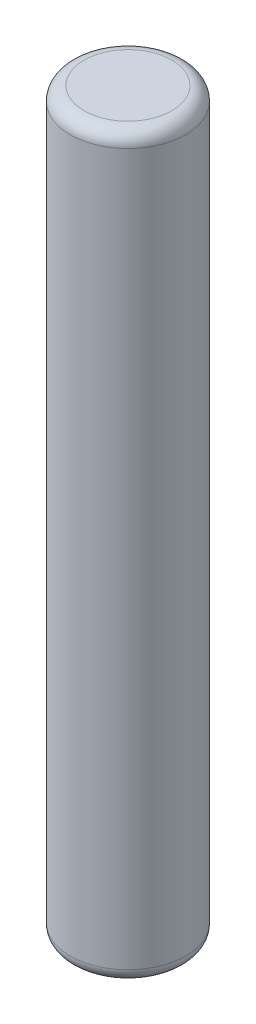
from build123d import *

# Parameters (mm, degrees)
SKETCH1_R             = 1.25
PROFILE_EXTRUDE_DEPTH = 16
DOVEL_FILET_R         = 0.3


with BuildPart() as part:
    # Sketch1 → profile_extrude (new body)
    with BuildSketch(Plane(origin=(0, 0, 0), x_dir=(1, 0, 0), z_dir=(0, 1, 0))):
        with Locations(Location((0, 0, 0), (0, 0, 270))):
            Circle(SKETCH1_R)
    extrude(amount=PROFILE_EXTRUDE_DEPTH)

    # dovel _filet
    dovel_filet_edges = [part.edges().sort_by_distance(p)[0] for p in [
        (0, 0, -1.25),
        (0, 16, -1.25),
    ]]
    fillet(dovel_filet_edges, radius=DOVEL_FILET_R)


solid = part.part
